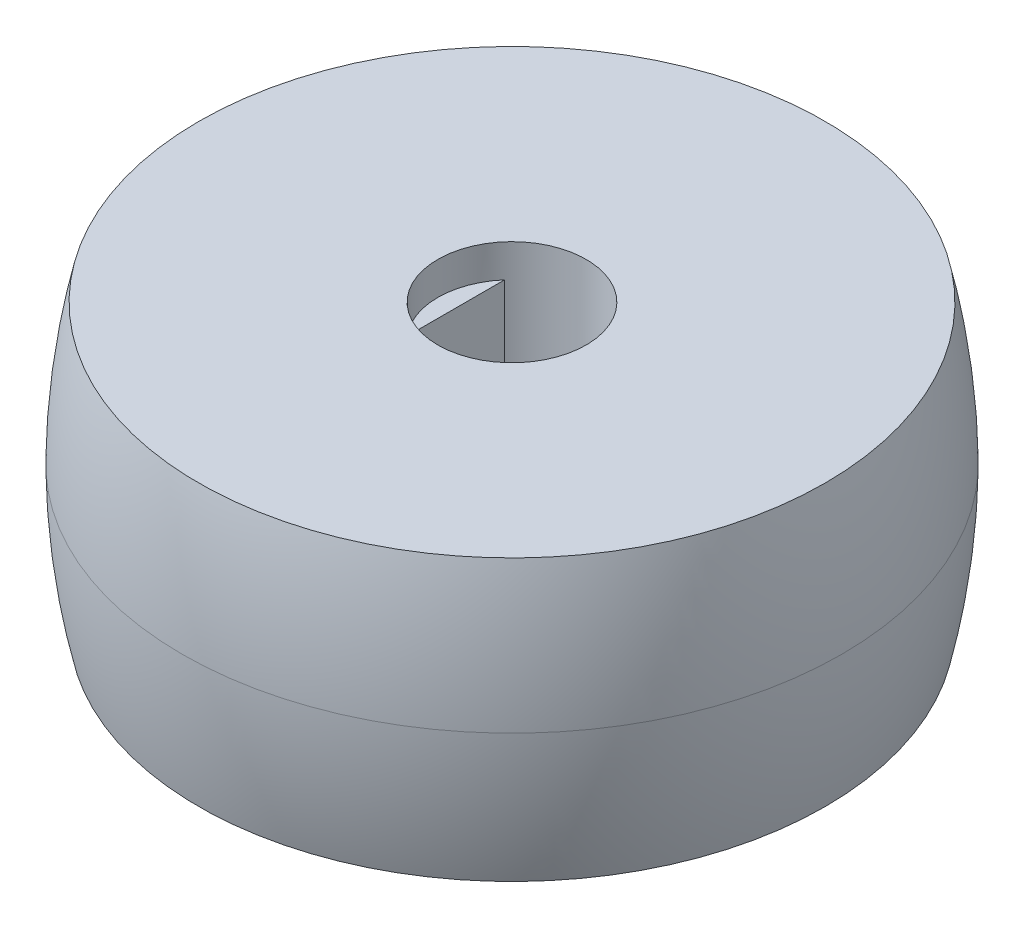
from build123d import *

# Parameters (mm, degrees)
SKETCH2_R          = 4.5
CUT_EXTRUDE1_DEPTH = 2
SKETCH2_3_R        = 1.65
CUT_EXTRUDE2_DEPTH = 34.000000173
CUT_EXTRUDE3_START = -2
SKETCH2_5_R        = 1.65
CUT_EXTRUDE3_DEPTH = 4.5


with BuildPart() as part:
    # Sketch1 → Revolve1 (revolve)
    with BuildSketch(Plane.XY, mode=Mode.PRIVATE) as revolve1_sk:
        with BuildLine():
            Line((0, -8.5), (19, -8.5))
            ThreePointArc((19, -8.5), (19.72799262, -4.276822661), (20, 0))
            Line((20, 0), (0, 0))
            Line((0, 0), (0, -8.5))
        make_face()
    revolve1 = revolve(revolve1_sk.sketch.rotate(Axis((0, 0, 0), (0, -1, 0)), 180), axis=Axis((0, 0, 0), (0, -1, 0)))

    # Mirror1: Revolve1 across plane
    add(revolve1.mirror(Plane.ZX))

    # Sketch2 → Cut-Extrude1 (cut)
    with BuildSketch(Plane(origin=(0, 8.5, 0), x_dir=(1, 0, 0), z_dir=(0, 1, 0))):
        with Locations(Location((0, 0, 0), (0, 0, 270))):
            Circle(SKETCH2_R)
    extrude(amount=-CUT_EXTRUDE1_DEPTH, mode=Mode.SUBTRACT)

    # Sketch2<3> → Cut-Extrude2 (cut, through all)
    with BuildSketch(Plane(origin=(0, 8.5, 0), x_dir=(1, 0, 0), z_dir=(0, 1, 0))):
        with Locations(Location((0, 0, 0), (0, 0, 270))):
            Circle(SKETCH2_3_R)
    extrude(amount=-CUT_EXTRUDE2_DEPTH, mode=Mode.SUBTRACT)

    # Sketch2<5> → Cut-Extrude3 (cut)
    with BuildSketch(Plane(origin=(0, 8.5, 0), x_dir=(1, 0, 0), z_dir=(0, 1, 0)).offset(CUT_EXTRUDE3_START)):
        with BuildLine():
            ThreePointArc((-3.4, -2.947880595), (0, -4.5), (3.4, -2.947880595))
            Line((3.4, -2.947880595), (3.4, 2.947880595))
            ThreePointArc((3.4, 2.947880595), (0, 4.5), (-3.4, 2.947880595))
            Line((-3.4, 2.947880595), (-3.4, -2.947880595))
        make_face()
        with Locations(Location((0, 0, 0), (0, 0, 270))):
            Circle(SKETCH2_5_R, mode=Mode.SUBTRACT)
    extrude(amount=-CUT_EXTRUDE3_DEPTH, mode=Mode.SUBTRACT)


solid = part.part
